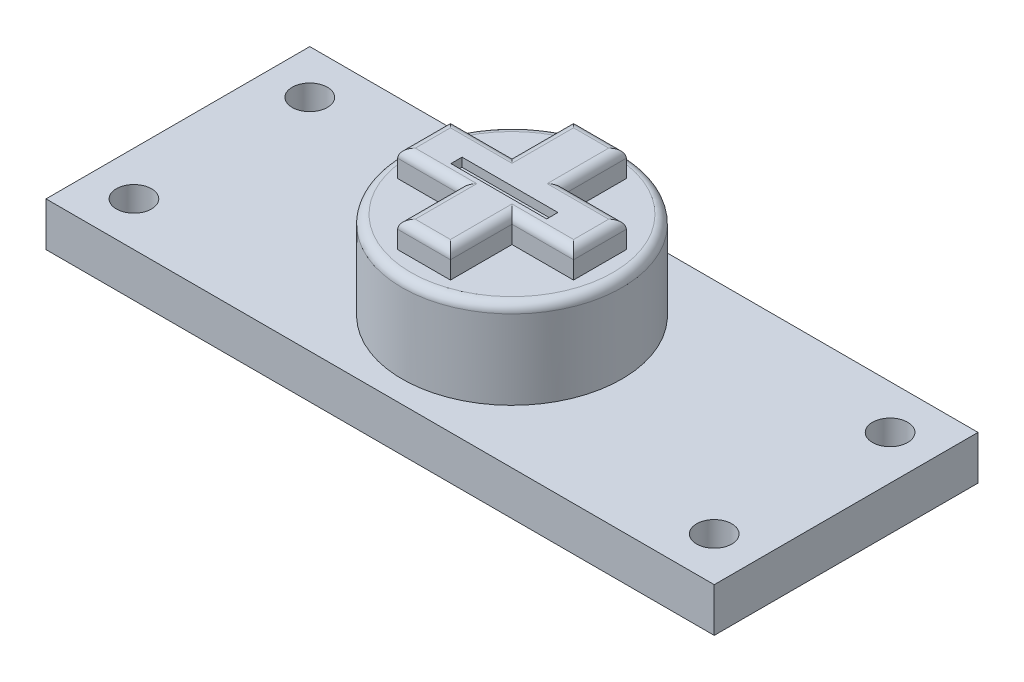
from build123d import *

# Parameters (mm, degrees)
SKETCH1_W           = 7600
SKETCH1_H           = 3000
BOSS_EXTRUDE1_DEPTH = 500
SKETCH2_R           = 200
CUT_EXTRUDE1_DEPTH  = 1000
SKETCH3_R           = 1250
BOSS_EXTRUDE2_DEPTH = 1000
BOSS_EXTRUDE3_DEPTH = 300
FILLET1_R           = 100
FILLET2_R           = 100
SKETCH6_W           = 1090.5
SKETCH6_H           = 127
CUT_EXTRUDE2_DEPTH  = 100


with BuildPart() as part:
    # Sketch1 → Boss-Extrude1 (new body)
    with BuildSketch(Plane(origin=(0, 0, 0), x_dir=(1, 0, 0), z_dir=(0, 1, 0))):
        Rectangle(SKETCH1_W, SKETCH1_H)
    extrude(amount=BOSS_EXTRUDE1_DEPTH)

    # Sketch2 → Cut-Extrude1 (cut)
    with BuildSketch(Plane(origin=(0, 500, 0), x_dir=(1, 0, 0), z_dir=(0, 1, 0))):
        with Locations(Location((-3300, -1000, 0), (0, 0, 270))):
            Circle(SKETCH2_R)
        with Locations(Location((-3300, 1000, 0), (0, 0, 270))):
            Circle(SKETCH2_R)
        with Locations(Location((3300, 1000, 0), (0, 0, 270))):
            Circle(SKETCH2_R)
        with Locations(Location((3300, -1000, 0), (0, 0, 270))):
            Circle(SKETCH2_R)
    extrude(amount=-CUT_EXTRUDE1_DEPTH, mode=Mode.SUBTRACT)

    # Sketch3 → Boss-Extrude2 (add)
    with BuildSketch(Plane(origin=(0, 500, 0), x_dir=(1, 0, 0), z_dir=(0, 1, 0))):
        with Locations(Location((0, 0, 0), (0, 0, 90))):
            Circle(SKETCH3_R)
    extrude(amount=BOSS_EXTRUDE2_DEPTH)

    # Sketch4 → Boss-Extrude3 (add)
    with BuildSketch(Plane(origin=(0, 1500, 0), x_dir=(1, 0, 0), z_dir=(0, 1, 0))):
        Polygon((-300, -300), (-300, -1000), (300, -1000), (300, -300), (1000, -300), (1000, 300), (300, 300), (300, 1000), (-300, 1000), (-300, 300), (-1000, 300), (-1000, -300), align=None)
    extrude(amount=BOSS_EXTRUDE3_DEPTH)

    # Fillet1
    fillet1_edges = [part.edges().sort_by_distance(p)[0] for p in [
        (300, 1800, 650),
        (650, 1800, 300),
        (1000, 1800, 0),
        (650, 1800, -300),
        (300, 1800, -650),
        (0, 1800, -1000),
        (-300, 1800, -650),
        (-650, 1800, -300),
        (-1000, 1800, 0),
        (-650, 1800, 300),
        (-300, 1800, 650),
        (0, 1800, 1000),
    ]]
    fillet(fillet1_edges, radius=FILLET1_R)

    # Fillet2
    fillet2_edges = [part.edges().sort_by_distance(p)[0] for p in [
        (0, 1500, 1250),
    ]]
    fillet(fillet2_edges, radius=FILLET2_R)

    # Sketch6 → Cut-Extrude2 (cut)
    with BuildSketch(Plane(origin=(0, 1800, 0), x_dir=(1, 0, 0), z_dir=(0, 1, 0))):
        with Locations((0, -86.5)):
            Rectangle(SKETCH6_W, SKETCH6_H)
    extrude(amount=-CUT_EXTRUDE2_DEPTH, mode=Mode.SUBTRACT)


solid = part.part
